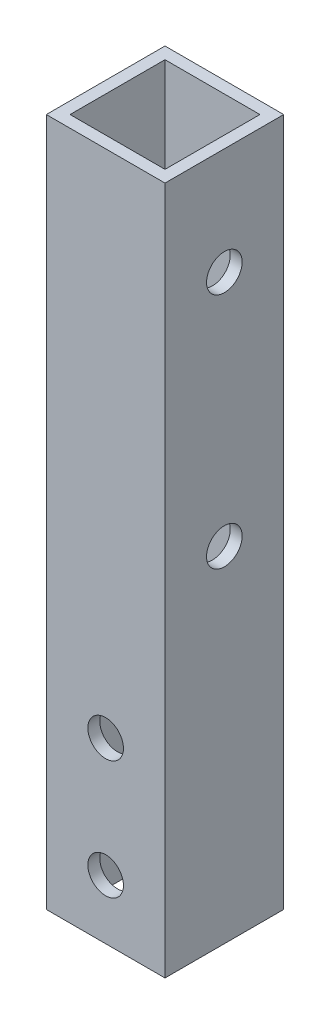
from build123d import *

# Parameters (mm, degrees)
SKETCH_1_W          = 10
SKETCH_1_H          = 10
SKETCH_1_W_2        = 8
SKETCH_1_H_2        = 8
EXTRUDE_1_DEPTH     = 58
SKETCH_2_R          = 1.5
CUT_EXTRUDE_1_DEPTH = 30
SKETCH_3_R          = 1.5
CUT_EXTRUDE_2_DEPTH = 30


with BuildPart() as part:
    # 草图1 → 凸台-拉伸1 (new body)
    with BuildSketch(Plane(origin=(0, 0, 0), x_dir=(1, 0, 0), z_dir=(0, 1, 0))):
        Rectangle(SKETCH_1_W, SKETCH_1_H)
        Rectangle(SKETCH_1_W_2, SKETCH_1_H_2, mode=Mode.SUBTRACT)
    extrude(amount=EXTRUDE_1_DEPTH)

    # 草图2 → 切除-拉伸1 (cut)
    with BuildSketch(Plane.XY.offset(5)):
        with Locations((0, 5)):
            Circle(SKETCH_2_R)
        with Locations((0, 15)):
            Circle(SKETCH_2_R)
    extrude(amount=-CUT_EXTRUDE_1_DEPTH, mode=Mode.SUBTRACT)

    # 草图3 → 切除-拉伸2 (cut)
    with BuildSketch(Plane.ZY.offset(5)):
        with Locations((0, 49)):
            Circle(SKETCH_3_R)
        with Locations((0, 29)):
            Circle(SKETCH_3_R)
    extrude(amount=-CUT_EXTRUDE_2_DEPTH, mode=Mode.SUBTRACT)


solid = part.part
